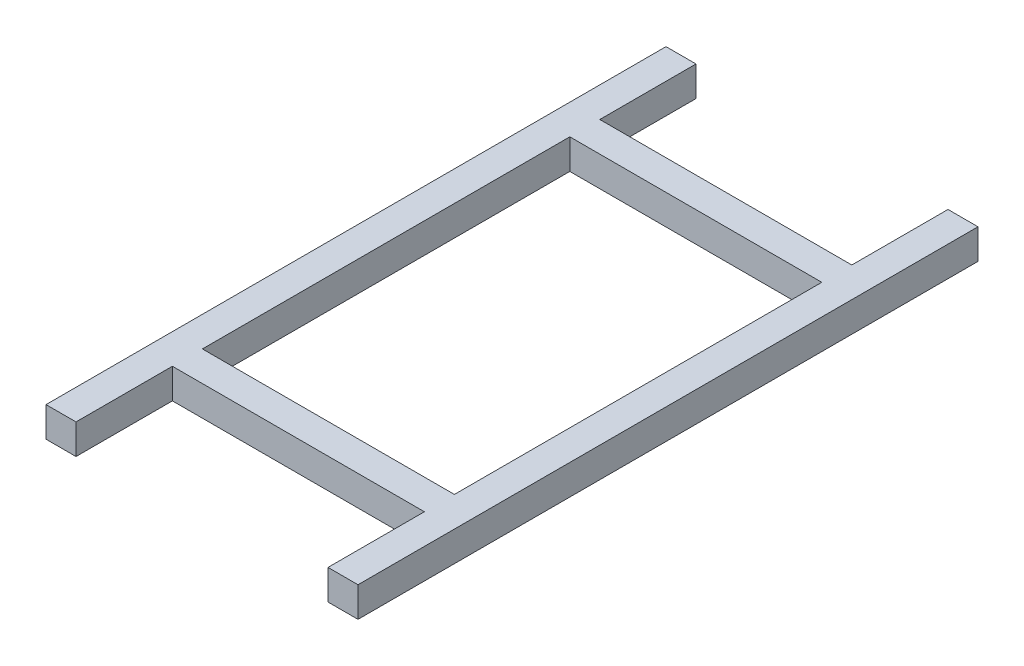
from build123d import *

# Parameters (mm, degrees)
SKETCH1_W             = 150
SKETCH1_H             = 150
BOSS_EXTRUDE1_DEPTH   = 3100
BOSS_EXTRUDE1_2_DEPTH = 3100
BOSS_EXTRUDE2_REACH   = 3409.661
SKETCH2_W             = 150
SKETCH2_H             = 150


with BuildPart() as part:
    # Sketch1 → Boss-Extrude1 (new body)
    with BuildSketch(Plane.XY):
        with Locations((1415.115935895, -43.539736266)):
            Rectangle(SKETCH1_W, SKETCH1_H)
    extrude(amount=BOSS_EXTRUDE1_DEPTH)

    # Sketch2 → Boss-Extrude2 (add, up to next)
    with BuildSketch(Plane(origin=(80.115935895, 0, 0), x_dir=(0, 0, -1), z_dir=(1, 0, 0)), mode=Mode.PRIVATE) as boss_extrude2_sk1:
        with Locations((-2543, -43.539736266)):
            Rectangle(SKETCH2_W, SKETCH2_H)
    boss_extrude2_tool1 = extrude(boss_extrude2_sk1.sketch, amount=BOSS_EXTRUDE2_REACH, mode=Mode.PRIVATE) - part.part
    # Sketch2 → Boss-Extrude2 (add, up to next)
    with BuildSketch(Plane(origin=(80.115935895, 0, 0), x_dir=(0, 0, -1), z_dir=(1, 0, 0)), mode=Mode.PRIVATE) as boss_extrude2_sk2:
        with Locations((-555.982528713, -43.539736266)):
            Rectangle(SKETCH2_W, SKETCH2_H)
    boss_extrude2_tool2 = extrude(boss_extrude2_sk2.sketch, amount=BOSS_EXTRUDE2_REACH, mode=Mode.PRIVATE) - part.part


with BuildPart() as body_2:
    # Sketch1 → Boss-Extrude1 2 (new body)
    with BuildSketch(Plane.XY):
        with Locations((5.115935895, -43.539736266)):
            Rectangle(SKETCH1_W, SKETCH1_H)
    extrude(amount=BOSS_EXTRUDE1_2_DEPTH)


with BuildPart() as part_1:
    add(part.part)

    add(body_2.part)  # Boss-Extrude2 merges body 2
    add(boss_extrude2_tool1.solids().sort_by_distance((80.115936, -43.539736, 2543))[0])
    add(boss_extrude2_tool2.solids().sort_by_distance((80.115936, -43.539736, 555.982529))[0])


solid = part_1.part
